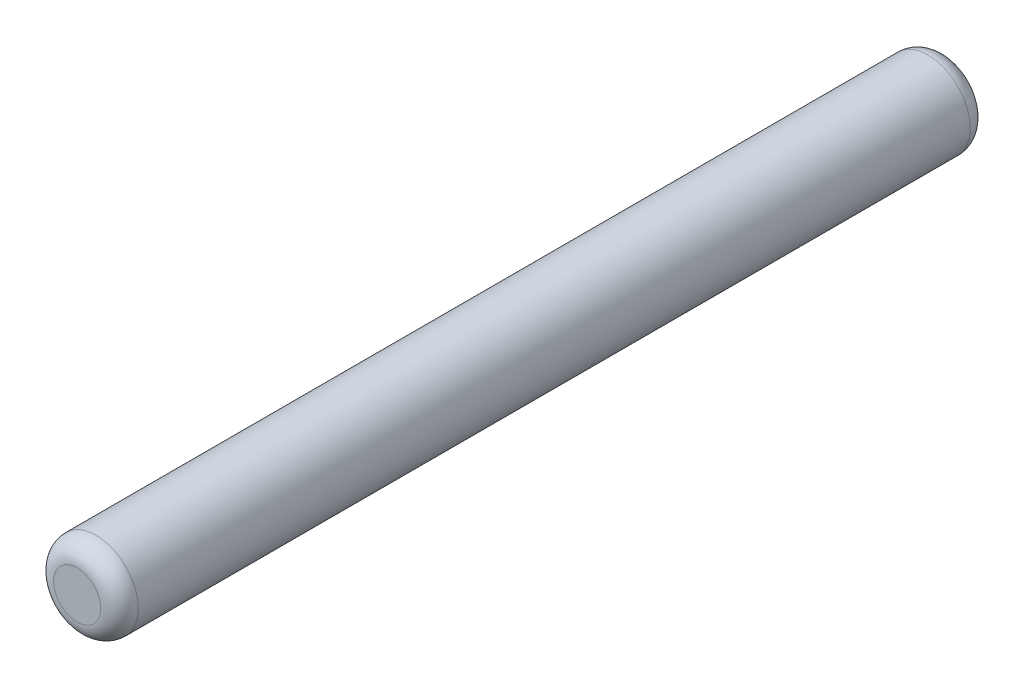
from build123d import *

# Parameters (mm, degrees)
SKETCH_1_R      = 1.8
EXTRUDE_1_DEPTH = 37
FILLET_1_R      = 0.8


with BuildPart() as part:
    # 스케치1 → 보스-돌출1 (new body)
    with BuildSketch(Plane.XY):
        Circle(SKETCH_1_R)
    extrude(amount=EXTRUDE_1_DEPTH)

    # 필렛1
    fillet_1_edges = [part.edges().sort_by_distance(p)[0] for p in [
        (-1.8, 0, 0),
        (-1.8, 0, 37),
    ]]
    fillet(fillet_1_edges, radius=FILLET_1_R)


solid = part.part
